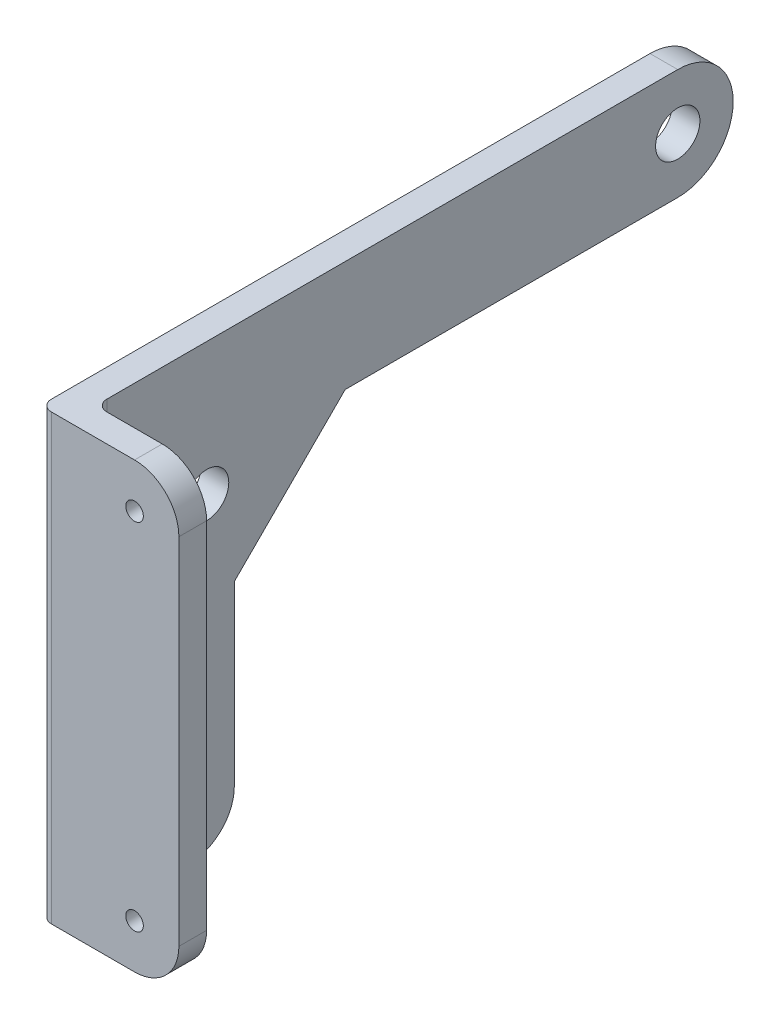
from build123d import *

# Parameters (mm, degrees)
SKETCH1_R                    = 20
EXTRUDE1_DEPTH               = 12.5
SKETCH2_W                    = 25
SKETCH2_H                    = 400
EXTRUDE2_DEPTH               = 100
FILLET1_R                    = 40
F_5_8_0_625_DIAMETER_HOLE1_D = 15.875
CHAMFER1_SIZE                = 100
FILLET2_R                    = 10


with BuildPart() as part:
    # Sketch1 → Extrude1 (new, symmetric)
    with BuildSketch(Plane(origin=(0, 0, 0), x_dir=(0, 0, -1), z_dir=(1, 0, 0))):
        with BuildLine():
            Line((0, 50), (-550, 50))
            Line((-550, 50), (-550, -350))
            Line((-550, -350), (-400, -350))
            Line((-400, -350), (-400, -50))
            Line((-400, -50), (0, -50))
            ThreePointArc((0, -50), (50, 0), (0, 50))
        make_face()
        Circle(SKETCH1_R, mode=Mode.SUBTRACT)
        with Locations((-425, -70)):
            Circle(SKETCH1_R, mode=Mode.SUBTRACT)
    extrude(amount=EXTRUDE1_DEPTH, both=True)

    # Sketch2 → Extrude2 (add)
    with BuildSketch(Plane(origin=(12.5, 0, 0), x_dir=(0, 0, -1), z_dir=(1, 0, 0))):
        with Locations((-537.5, -150)):
            Rectangle(SKETCH2_W, SKETCH2_H)
    extrude(amount=EXTRUDE2_DEPTH)

    # Fillet1
    fillet1_edges = [part.edges().sort_by_distance(p)[0] for p in [
        (112.5, -350, 537.5),
        (112.5, 50, 537.5),
        (0, -350, 400),
    ]]
    fillet(fillet1_edges, radius=FILLET1_R)

    # 5/8 (0.625) Diameter Hole1 (through all)
    with Locations(Plane.XY.offset(550)):
        with Locations((72.5, 10), (72.5, -310)):
            Hole(F_5_8_0_625_DIAMETER_HOLE1_D / 2)

    # Chamfer1
    chamfer1_edges = [part.edges().sort_by_distance(p)[0] for p in [
        (0, -50, 400),
    ]]
    chamfer(chamfer1_edges, length=CHAMFER1_SIZE)

    # Fillet2
    fillet2_edges = [part.edges().sort_by_distance(p)[0] for p in [
        (12.5, -150, 525),
        (-12.5, -150, 550),
    ]]
    fillet(fillet2_edges, radius=FILLET2_R)


solid = part.part
